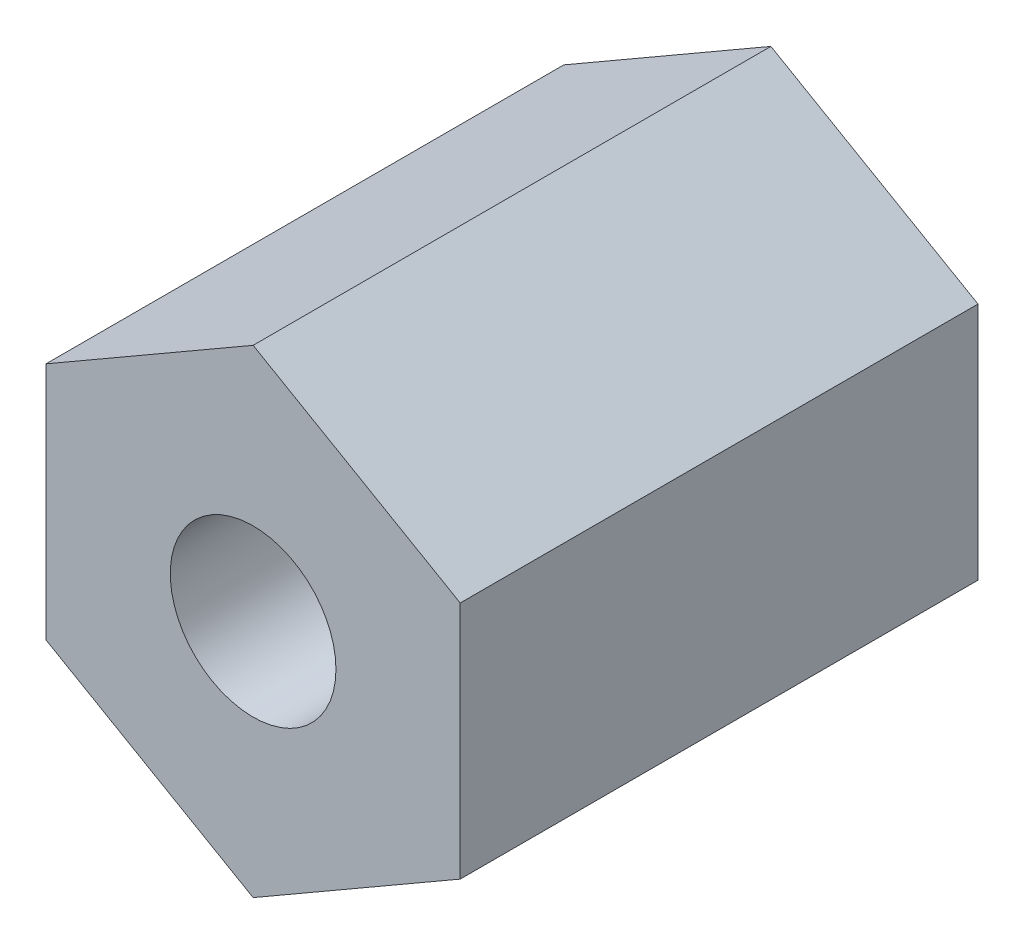
from build123d import *

# Parameters (mm, degrees)
SKETCH_1_R            = 0.8
BRASS_AF4_L5_M2_DEPTH = 5


with BuildPart() as part:
    # 草图1 → Brass_AF4_L5_M2 (new body)
    with BuildSketch(Plane.XY):
        Polygon((2, 1.154700538), (0, 2.309401077), (-2, 1.154700538), (-2, -1.154700538), (0, -2.309401077), (2, -1.154700538), align=None)
        Circle(SKETCH_1_R, mode=Mode.SUBTRACT)
    extrude(amount=BRASS_AF4_L5_M2_DEPTH)


solid = part.part
